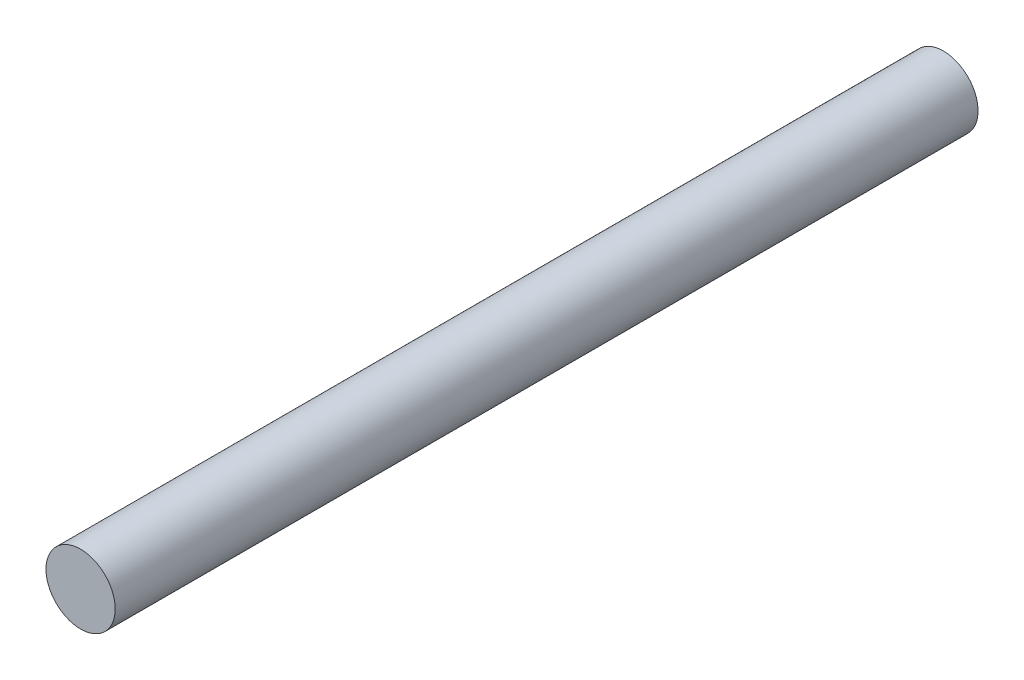
from build123d import *

# Parameters (mm, degrees)
SKETCH_1_R      = 14.44
EXTRUDE_1_DEPTH = 360


with BuildPart() as part:
    # 草图1 → 凸台-拉伸1 (new body)
    with BuildSketch(Plane.XY):
        with Locations(Location((0, 0, 0), (0, 0, 180))):
            Circle(SKETCH_1_R)
    extrude(amount=EXTRUDE_1_DEPTH)


solid = part.part
